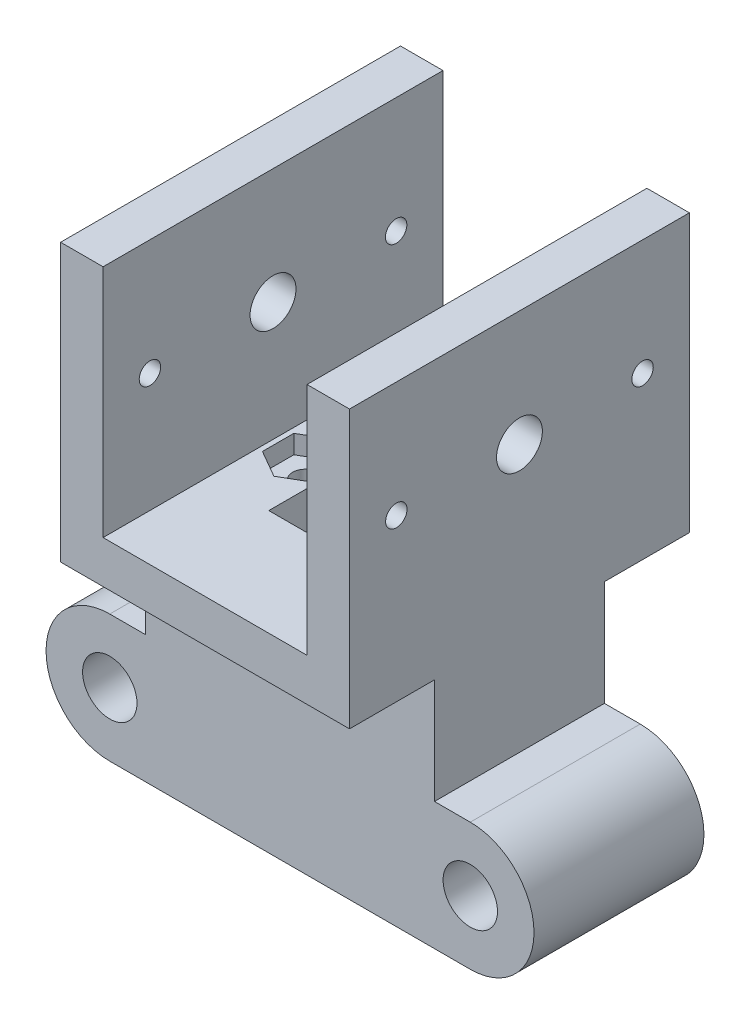
from build123d import *

# Parameters (mm, degrees)
BOSS_EXTRUDE1_DEPTH      = 12.7
BOSS_EXTRUDE1_DEPTH_BACK = 12.7
SKETCH1_R                = 4.064
SKETCH9_W                = 30.48
SKETCH9_H                = 35.052
CUT_EXTRUDE6_DEPTH       = 60.613097773
BOSS_EXTRUDE3_DEPTH      = 12.7
SKETCH11_W               = 5.350768363
SKETCH11_H               = 57.15
CUT_EXTRUDE7_DEPTH       = 75.08914513
SKETCH12_W               = 12.7
SKETCH12_H               = 19.05
CUT_EXTRUDE8_DEPTH       = 89.211973463
SKETCH14_R               = 1.6
CUT_EXTRUDE9_DEPTH       = 75.795998583
SKETCH15_R               = 3.429
CUT_EXTRUDE10_DEPTH      = 75.795998583
CUT_EXTRUDE11_DEPTH      = 2.778125
F_6_CLEARANCE_HOLE1_D    = 3.7973
SKETCH23_R               = 3.175
CUT_EXTRUDE12_DEPTH      = 22.225
CUT_EXTRUDE13_REACH      = 68.032
SKETCH24_W               = 12.7
SKETCH24_H               = 19.05


with BuildPart() as part:
    # Sketch1 → Boss-Extrude1 (new, two sides: drawn at the far end of the back side and taken through both)
    with BuildSketch(Plane.XY.offset(-BOSS_EXTRUDE1_DEPTH_BACK)):
        with BuildLine():
            Line((-26.940768363, -17.415768363), (-26.940768363, 39.734231637))
            Line((-26.940768363, 39.734231637), (26.940768363, 39.734231637))
            Line((26.940768363, 39.734231637), (26.940768363, -17.415768363))
            ThreePointArc((26.940768363, -17.415768363), (36.465768363, -26.940768363), (26.940768363, -36.465768363))
            Line((26.940768363, -36.465768363), (-26.940768363, -36.465768363))
            ThreePointArc((-26.940768363, -36.465768363), (-36.465768363, -26.940768363), (-26.940768363, -17.415768363))
        make_face()
        with Locations((-26.940768363, -26.940768363)):
            Circle(SKETCH1_R, mode=Mode.SUBTRACT)
        with Locations((26.940768363, -26.940768363)):
            Circle(SKETCH1_R, mode=Mode.SUBTRACT)
    extrude(amount=BOSS_EXTRUDE1_DEPTH + BOSS_EXTRUDE1_DEPTH_BACK)

    # Sketch9 → Cut-Extrude6 (cut, through all)
    with BuildSketch(Plane.XY.offset(12.7)):
        with Locations((0, 22.208231637)):
            Rectangle(SKETCH9_W, SKETCH9_H)
    extrude(amount=-CUT_EXTRUDE6_DEPTH, mode=Mode.SUBTRACT)

    # Sketch10 → Boss-Extrude3 (add)
    with BuildSketch(Plane.XY.offset(12.7)):
        Polygon((-26.940768363, 39.734231637), (-26.940768363, -1.667768363), (26.940768363, -1.667768363), (26.940768363, 39.734231637), (15.24, 39.734231637), (15.24, 4.682231637), (-15.24, 4.682231637), (-15.24, 39.734231637), align=None)
    boss_extrude3 = extrude(amount=BOSS_EXTRUDE3_DEPTH)

    # Mirror4: Boss-Extrude3 across plane
    add(boss_extrude3.mirror(Plane.XY))

    # Sketch11 → Cut-Extrude7 (cut, through all)
    with BuildSketch(Plane.XY.offset(25.4)):
        with Locations((-24.265384181, 11.159231637)):
            Rectangle(SKETCH11_W, SKETCH11_H)
    cut_extrude7 = extrude(amount=-CUT_EXTRUDE7_DEPTH, mode=Mode.SUBTRACT)

    # Mirror5: Cut-Extrude7 across plane
    add(cut_extrude7.mirror(Plane(origin=(0, 0, 0), x_dir=(0, 0, 1), z_dir=(1, 0, 0))), mode=Mode.SUBTRACT)

    # Sketch12 → Cut-Extrude8 (cut, through all)
    with BuildSketch(Plane.XZ.offset(36.465768363)):
        Rectangle(SKETCH12_W, SKETCH12_H)
    extrude(amount=-CUT_EXTRUDE8_DEPTH, mode=Mode.SUBTRACT)

    # Sketch14 → Cut-Extrude9 (cut, through all)
    with BuildSketch(Plane.ZY.offset(21.59)):
        with Locations((-18.4, 22.462231637)):
            Circle(SKETCH14_R)
    cut_extrude9 = extrude(amount=-CUT_EXTRUDE9_DEPTH, mode=Mode.SUBTRACT)

    # Mirror6: Cut-Extrude9 across plane
    add(cut_extrude9.mirror(Plane.XY), mode=Mode.SUBTRACT)

    # Sketch15 → Cut-Extrude10 (cut, through all)
    with BuildSketch(Plane(origin=(21.59, 0, 0), x_dir=(0, 0, -1), z_dir=(1, 0, 0))):
        with Locations((0, 22.462231637)):
            Circle(SKETCH15_R)
    extrude(amount=-CUT_EXTRUDE10_DEPTH, mode=Mode.SUBTRACT)

    # Sketch18 → Cut-Extrude11 (cut)
    with BuildSketch(Plane(origin=(0, 4.682231637, 0), x_dir=(1, 0, 0), z_dir=(0, 1, 0))):
        Polygon((-6.35, 2.346351494), (-10.414, 4.692702988), (-14.478, 2.346351494), (-14.478, -2.346351494), (-10.414, -4.692702988), (-6.35, -2.346351494), align=None)
    cut_extrude11 = extrude(amount=-CUT_EXTRUDE11_DEPTH, mode=Mode.SUBTRACT)

    # Mirror7: Cut-Extrude11 across plane
    add(cut_extrude11.mirror(Plane(origin=(0, 0, 0), x_dir=(0, 0, 1), z_dir=(1, 0, 0))), mode=Mode.SUBTRACT)

    # #6 Clearance Hole1 (through all)
    with Locations(Plane(origin=(0, 1.904106637, 0), x_dir=(1, 0, 0), z_dir=(0, 1, 0))):
        with Locations((-10.414, 0)):
            f_6_clearance_hole1 = Hole(F_6_CLEARANCE_HOLE1_D / 2)

    # Mirror8: #6 Clearance Hole1 across plane
    add(f_6_clearance_hole1.mirror(Plane(origin=(0, 0, 0), x_dir=(0, 0, 1), z_dir=(1, 0, 0))), mode=Mode.SUBTRACT)

    # Sketch23 → Cut-Extrude12 (cut)
    with BuildSketch(Plane.XZ.offset(36.465768363)):
        with Locations((-10.414, 0)):
            Circle(SKETCH23_R)
        with Locations((10.414, 0)):
            Circle(SKETCH23_R)
    extrude(amount=-CUT_EXTRUDE12_DEPTH, mode=Mode.SUBTRACT)

    # Sketch24 → Cut-Extrude13 (cut, up to next)
    with BuildSketch(Plane(origin=(0, 0, -12.7), x_dir=(-1, 0, 0), z_dir=(0, 0, -1)), mode=Mode.PRIVATE) as cut_extrude13_sk1:
        with Locations((0, -20.717768363)):
            Rectangle(SKETCH24_W, SKETCH24_H)
    cut_extrude13_tool1 = extrude(cut_extrude13_sk1.sketch, amount=-CUT_EXTRUDE13_REACH, mode=Mode.PRIVATE) & part.part
    add(cut_extrude13_tool1.solids().sort_by_distance((0, -20.717768, -12.7))[0], mode=Mode.SUBTRACT)


solid = part.part
